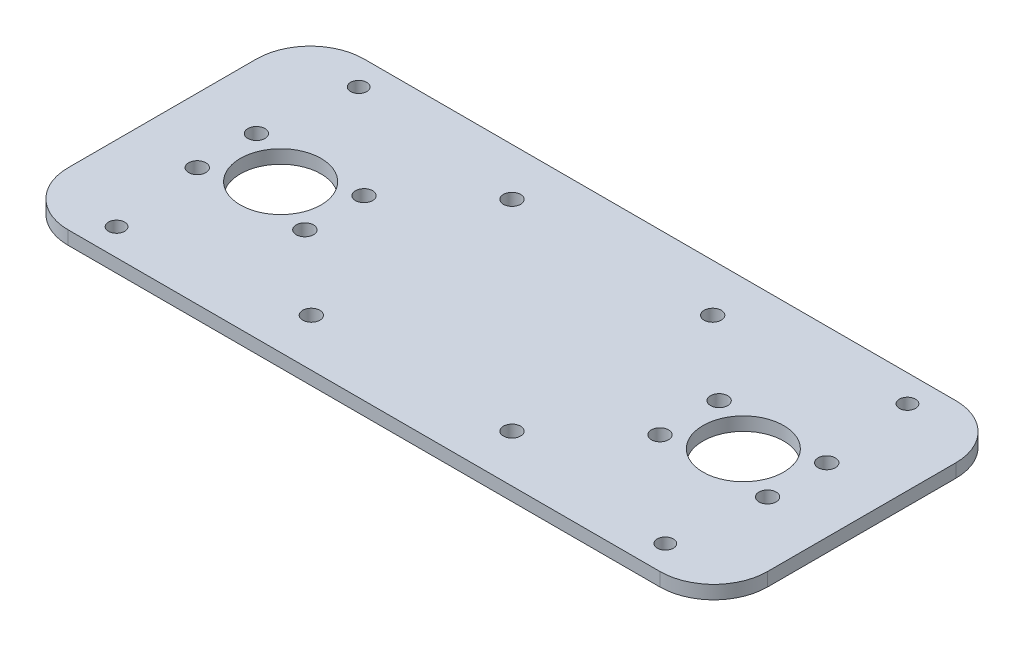
from build123d import *

# Parameters (mm, degrees)
BOSS_EXTRUDE1_DEPTH = 2.5
SKETCH2_R           = 1.5
CUT_EXTRUDE1_DEPTH  = 142.178079035
SKETCH3_R           = 1.6
CUT_EXTRUDE2_DEPTH  = 10
SKETCH4_R           = 1.6
CUT_EXTRUDE3_DEPTH  = 10
SKETCH5_R           = 1.6
CUT_EXTRUDE4_DEPTH  = 10
SKETCH8_R           = 1.6
CUT_EXTRUDE5_DEPTH  = 10
SKETCH9_R           = 1.6
CUT_EXTRUDE6_DEPTH  = 10
SKETCH10_R          = 7.5
CUT_EXTRUDE7_DEPTH  = 10


with BuildPart() as part:
    # Sketch1 → Boss-Extrude1 (new body)
    with BuildSketch(Plane(origin=(0, 0, 0), x_dir=(1, 0, 0), z_dir=(0, 1, 0))):
        with BuildLine():
            Line((10, 0), (120, 0))
            ThreePointArc((120, 0), (127.071067812, 2.928932188), (130, 10))
            Line((130, 10), (130, 45))
            ThreePointArc((130, 45), (127.071067812, 52.071067812), (120, 55))
            Line((120, 55), (10, 55))
            ThreePointArc((10, 55), (2.928932188, 52.071067812), (0, 45))
            Line((0, 45), (0, 10))
            ThreePointArc((0, 10), (2.928932188, 2.928932188), (10, 0))
        make_face()
    extrude(amount=BOSS_EXTRUDE1_DEPTH)

    # Sketch2 → Cut-Extrude1 (cut, through all)
    with BuildSketch(Plane(origin=(0, 2.5, 0), x_dir=(1, 0, 0), z_dir=(0, 1, 0))):
        with Locations(Location((14, 5, 0), (0, 0, 270))):
            Circle(SKETCH2_R)
        with Locations(Location((14, 50, 0), (0, 0, 270))):
            Circle(SKETCH2_R)
        with Locations(Location((116, 5, 0), (0, 0, 90))):
            Circle(SKETCH2_R)
        with Locations(Location((116, 50, 0), (0, 0, 90))):
            Circle(SKETCH2_R)
    extrude(amount=-CUT_EXTRUDE1_DEPTH, mode=Mode.SUBTRACT)

    # Sketch3 → Cut-Extrude2 (cut)
    with BuildSketch(Plane(origin=(0, 2.5, 0), x_dir=(1, 0, 0), z_dir=(0, 1, 0))):
        with Locations(Location((12, 33, 0), (0, 0, 270))):
            Circle(SKETCH3_R)
    extrude(amount=-CUT_EXTRUDE2_DEPTH, mode=Mode.SUBTRACT)

    # Sketch4 → Cut-Extrude3 (cut)
    with BuildSketch(Plane(origin=(0, 2.5, 0), x_dir=(1, 0, 0), z_dir=(0, 1, 0))):
        with Locations(Location((12, 22, 0), (0, 0, 270))):
            Circle(SKETCH4_R)
    extrude(amount=-CUT_EXTRUDE3_DEPTH, mode=Mode.SUBTRACT)

    # Sketch5 → Cut-Extrude4 (cut)
    with BuildSketch(Plane(origin=(0, 2.5, 0), x_dir=(1, 0, 0), z_dir=(0, 1, 0))):
        with Locations(Location((32, 33, 0), (0, 0, 270))):
            Circle(SKETCH5_R)
        with Locations(Location((32, 22, 0), (0, 0, 270))):
            Circle(SKETCH5_R)
    extrude(amount=-CUT_EXTRUDE4_DEPTH, mode=Mode.SUBTRACT)

    # Sketch8 → Cut-Extrude5 (cut)
    with BuildSketch(Plane(origin=(0, 2.5, 0), x_dir=(1, 0, 0), z_dir=(0, 1, 0))):
        with Locations(Location((98, 33, 0), (0, 0, 270))):
            Circle(SKETCH8_R)
        with Locations(Location((98, 22, 0), (0, 0, 270))):
            Circle(SKETCH8_R)
        with Locations(Location((118, 33, 0), (0, 0, 270))):
            Circle(SKETCH8_R)
        with Locations(Location((118, 22, 0), (0, 0, 270))):
            Circle(SKETCH8_R)
    extrude(amount=-CUT_EXTRUDE5_DEPTH, mode=Mode.SUBTRACT)

    # Sketch9 → Cut-Extrude6 (cut)
    with BuildSketch(Plane(origin=(0, 2.5, 0), x_dir=(1, 0, 0), z_dir=(0, 1, 0))):
        with Locations(Location((46.35, 46.15, 0), (0, 0, 270))):
            Circle(SKETCH9_R)
        with Locations(Location((83.65, 46.15, 0), (0, 0, 270))):
            Circle(SKETCH9_R)
        with Locations(Location((83.65, 8.85, 0), (0, 0, 270))):
            Circle(SKETCH9_R)
        with Locations(Location((46.35, 8.85, 0), (0, 0, 270))):
            Circle(SKETCH9_R)
    extrude(amount=-CUT_EXTRUDE6_DEPTH, mode=Mode.SUBTRACT)

    # Sketch10 → Cut-Extrude7 (cut)
    with BuildSketch(Plane.XZ):
        with Locations(Location((22, -27.5, 0), (0, 0, 270))):
            Circle(SKETCH10_R)
        with Locations(Location((108, -27.5, 0), (0, 0, 90))):
            Circle(SKETCH10_R)
    extrude(amount=-CUT_EXTRUDE7_DEPTH, mode=Mode.SUBTRACT)


solid = part.part
